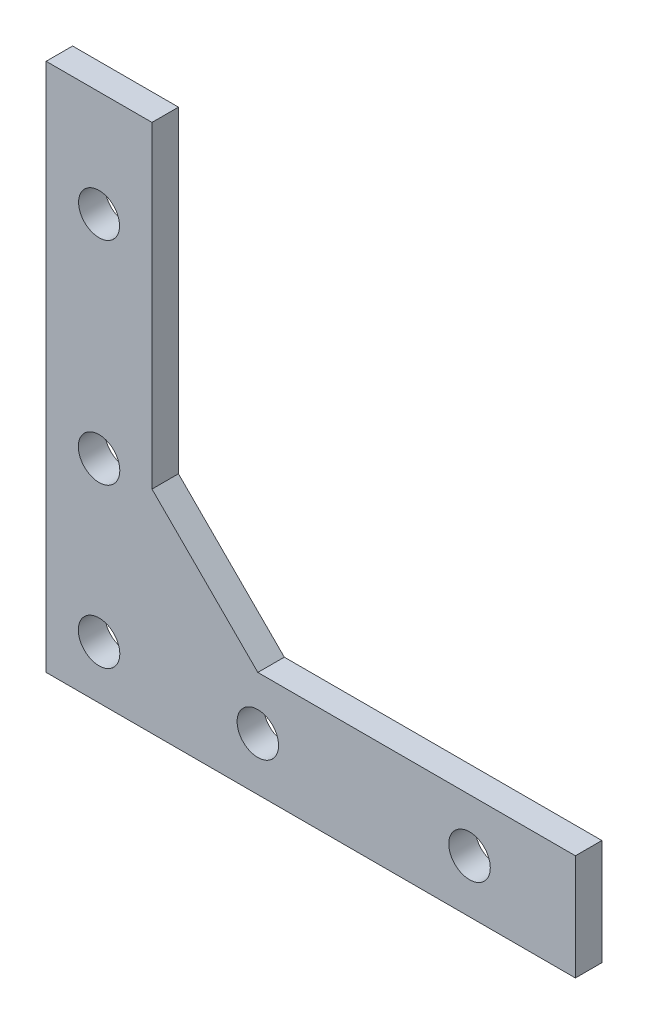
from build123d import *

# Parameters (mm, degrees)
BOSS_EXTRUDE1_DEPTH          = 3.175
F_10_CLEARANCE_HOLE1_D       = 4.9784
F_10_0_1935_DIAMETER_HOLE1_D = 4.9149


with BuildPart() as part:
    # Sketch1 → Boss-Extrude1 (new body)
    with BuildSketch(Plane.XY):
        Polygon((-253.5966335, 0), (-266.700000508, 0), (-266.700000508, 63.5), (-254.000000508, 63.5), (-254.000000508, 25.4), (-241.300000508, 12.7), (-203.200000508, 12.7), (-203.200000508, 0), align=None)
    extrude(amount=BOSS_EXTRUDE1_DEPTH)

    # #10 Clearance Hole1 (through all)
    with Locations(Plane.XY.offset(3.175)):
        with Locations((-260.350000508, 6.35), (-260.350000508, 25.4), (-241.300000508, 6.35), (-215.900000508, 6.35)):
            Hole(F_10_CLEARANCE_HOLE1_D / 2)

    # #10 (0.1935) Diameter Hole1 (through all)
    with Locations(Plane.XY.offset(3.175)):
        with Locations((-260.350000508, 50.8)):
            Hole(F_10_0_1935_DIAMETER_HOLE1_D / 2)


solid = part.part
